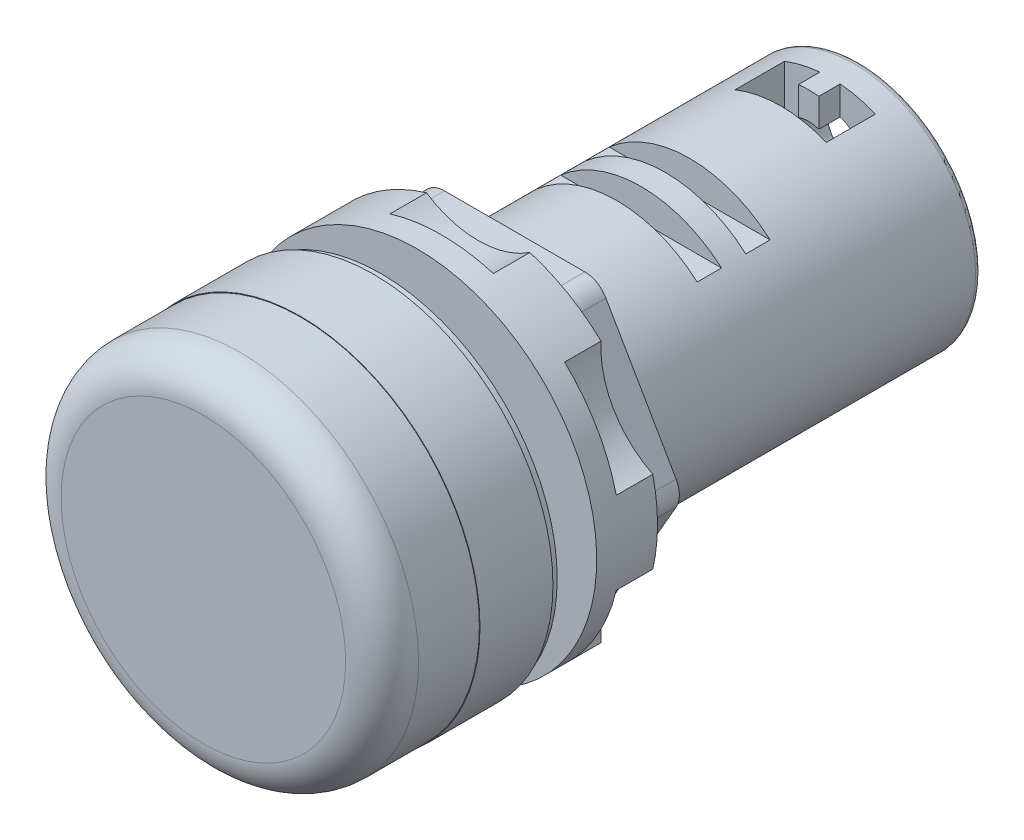
from build123d import *

# Parameters (mm, degrees)
ESBO_O1_R             = 14.75
EXTRUS_O1_DEPTH       = 6
ESBO_O2_R             = 10
EXTRUS_O2_DEPTH       = 40
ESBO_O3_R             = 11
EXTRUS_O3_DEPTH       = 5
ESBO_O4_R             = 14.7
ESBO_O4_R_2           = 12.5
EXTRUS_O4_DEPTH       = 8
EXTRUS_O5_START       = -2
ESBO_O5_R             = 14.7
EXTRUS_O5_DEPTH       = 2
FILETE2_R             = 3
ESBO_O6_R             = 14.5
EXTRUS_O6_DEPTH       = 0.6
EXTRUS_O7_START       = 8
ESBO_O7_R             = 14.75
EXTRUS_O7_DEPTH       = 5
CORTE_EXTRUS_O1_DEPTH = 3
CIRPATTERN1_COUNT     = 6
EXTRUS_O8_DEPTH       = 3
FILETE3_R             = 0.5
CORTE_EXTRUS_O2_START = -14
ESBO_O10_W            = 40
ESBO_O10_H            = 25
ESBO_O10_W_2          = 30
ESBO_O10_H_2          = 15
CORTE_EXTRUS_O2_DEPTH = 2
LPATTERN1_COUNT       = 2
LPATTERN1_PITCH       = 4
ESBO_O11_R            = 2.75
CORTE_EXTRUS_O3_DEPTH = 5
CORTE_EXTRUS_O4_DEPTH = 12.5


with BuildPart() as part:
    # Esboço1 → Extrusão1 (new body)
    with BuildSketch(Plane.XY):
        Circle(ESBO_O1_R)
    extrude(amount=EXTRUS_O1_DEPTH)

    # Esboço2 → Extrusão2 (add)
    with BuildSketch(Plane(origin=(0, 0, 0), x_dir=(-1, 0, 0), z_dir=(0, 0, -1))):
        with Locations(Location((0, 0, 0), (0, 0, 180))):
            Circle(ESBO_O2_R)
    extrude(amount=EXTRUS_O2_DEPTH)

    # Esboço3 → Extrusão3 (add)
    with BuildSketch(Plane.XY.offset(6)):
        Circle(ESBO_O3_R)
    extrude(amount=EXTRUS_O3_DEPTH)

    # Esboço4 → Extrusão4 (add)
    with BuildSketch(Plane.XY.offset(6)):
        Circle(ESBO_O4_R)
        Circle(ESBO_O4_R_2, mode=Mode.SUBTRACT)
    extrude(amount=EXTRUS_O4_DEPTH)

    # Esboço5 → Extrusão5 (add)
    with BuildSketch(Plane.XY.offset(14).offset(EXTRUS_O5_START)):
        Circle(ESBO_O5_R)
    extrude(amount=EXTRUS_O5_DEPTH)

    # Filete2
    filete2_edges = [part.edges().sort_by_distance(p)[0] for p in [
        (-14.7, 0, 14),
    ]]
    fillet(filete2_edges, radius=FILETE2_R)

    # Esboço6 → Extrusão6 (add)
    with BuildSketch(Plane(origin=(0, 0, 0), x_dir=(-1, 0, 0), z_dir=(0, 0, -1))):
        with Locations(Location((0, 0, 0), (0, 0, 180))):
            Circle(ESBO_O6_R)
    extrude(amount=EXTRUS_O6_DEPTH)

    # Esboço7 → Extrusão7 (add)
    with BuildSketch(Plane(origin=(0, 0, -0.6), x_dir=(-1, 0, 0), z_dir=(0, 0, -1)).offset(EXTRUS_O7_START)):
        with Locations(Location((0, 0, 0), (0, 0, 180))):
            Circle(ESBO_O7_R)
    extrude(amount=-EXTRUS_O7_DEPTH)

    # Esboço8 → Corte-extrusão1 (cut)
    with BuildSketch(Plane(origin=(0, 0, -8.6), x_dir=(-1, 0, 0), z_dir=(0, 0, -1))):
        with BuildLine():
            ThreePointArc((-4.25, 14.124446892), (0, 12.843637989), (4.25, 14.124446892))
            ThreePointArc((4.25, 14.124446892), (0, 15.884854532), (-4.25, 14.124446892))
        make_face()
    corte_extrus_o1 = extrude(amount=-CORTE_EXTRUS_O1_DEPTH, mode=Mode.SUBTRACT)

    # CirPattern1: Corte-extrusão1 ×6 about axis
    cirpattern1_axis = Axis((0, 0, 0), (0, 0, 1))
    for i in range(1, CIRPATTERN1_COUNT):
        add(corte_extrus_o1.rotate(cirpattern1_axis, i * 360 / CIRPATTERN1_COUNT), mode=Mode.SUBTRACT)

    # Esboço9 → Extrusão8 (add)
    with BuildSketch(Plane(origin=(0, 0, -8.6), x_dir=(-1, 0, 0), z_dir=(0, 0, -1))):
        with BuildLine():
            Line((-7.505553499, 11), (-13.279056191, 1))
            ThreePointArc((-13.279056191, 1), (-13.547005384, 0), (-13.279056191, -1))
            Line((-13.279056191, -1), (-7.505553499, -11))
            ThreePointArc((-7.505553499, -11), (-6.773502692, -11.732050808), (-5.773502692, -12))
            Line((-5.773502692, -12), (5.773502692, -12))
            ThreePointArc((5.773502692, -12), (6.773502692, -11.732050808), (7.505553499, -11))
            Line((7.505553499, -11), (13.279056191, -1))
            ThreePointArc((13.279056191, -1), (13.547005384, 0), (13.279056191, 1))
            Line((13.279056191, 1), (7.505553499, 11))
            ThreePointArc((7.505553499, 11), (6.773502692, 11.732050808), (5.773502692, 12))
            Line((5.773502692, 12), (-5.773502692, 12))
            ThreePointArc((-5.773502692, 12), (-6.773502692, 11.732050808), (-7.505553499, 11))
        make_face()
    extrude(amount=EXTRUS_O8_DEPTH)

    # Filete3
    filete3_edges = [part.edges().sort_by_distance(p)[0] for p in [
        (-10, 0, -40),
    ]]
    fillet(filete3_edges, radius=FILETE3_R)

    # Esboço10 → Corte-extrusão2 (cut)
    with BuildSketch(Plane(origin=(0, 0, -40), x_dir=(-1, 0, 0), z_dir=(0, 0, -1)).offset(CORTE_EXTRUS_O2_START)):
        Rectangle(ESBO_O10_W, ESBO_O10_H)
        Rectangle(ESBO_O10_W_2, ESBO_O10_H_2, mode=Mode.SUBTRACT)
    corte_extrus_o2 = extrude(amount=-CORTE_EXTRUS_O2_DEPTH, mode=Mode.SUBTRACT)

    # LPattern1: Corte-extrusão2 ×2
    with Locations(*[(0, 0, i * LPATTERN1_PITCH) for i in range(1, LPATTERN1_COUNT)]):
        add(corte_extrus_o2, mode=Mode.SUBTRACT)

    # Esboço11 → Corte-extrusão3 (cut)
    with BuildSketch(Plane(origin=(0, 0, -40), x_dir=(-1, 0, 0), z_dir=(0, 0, -1))):
        with Locations((0, 5)):
            Circle(ESBO_O11_R)
        with Locations(Location((0, -5, 0), (0, 0, 180))):
            Circle(ESBO_O11_R)
    extrude(amount=-CORTE_EXTRUS_O3_DEPTH, mode=Mode.SUBTRACT)

    # 3DSketch2 → Corte-extrusão4 (cut, symmetric)
    with BuildSketch(Plane(origin=(-3.75, 0, -37.527086784), x_dir=(0.8800460423188995, 0, 0.4748883694078451), z_dir=(0, -1, 0))):
        Polygon((0, 0), (2.571694256, -1.387731588), (3.404519941, 0.155631013), (4.879432804, -0.640257987), (4.046607118, -2.183620587), (6.600345317, -3.561662771), (8.52228138, 0), (1.921937352, 3.56166516), align=None)
    extrude(amount=CORTE_EXTRUS_O4_DEPTH, both=True, mode=Mode.SUBTRACT)


solid = part.part
